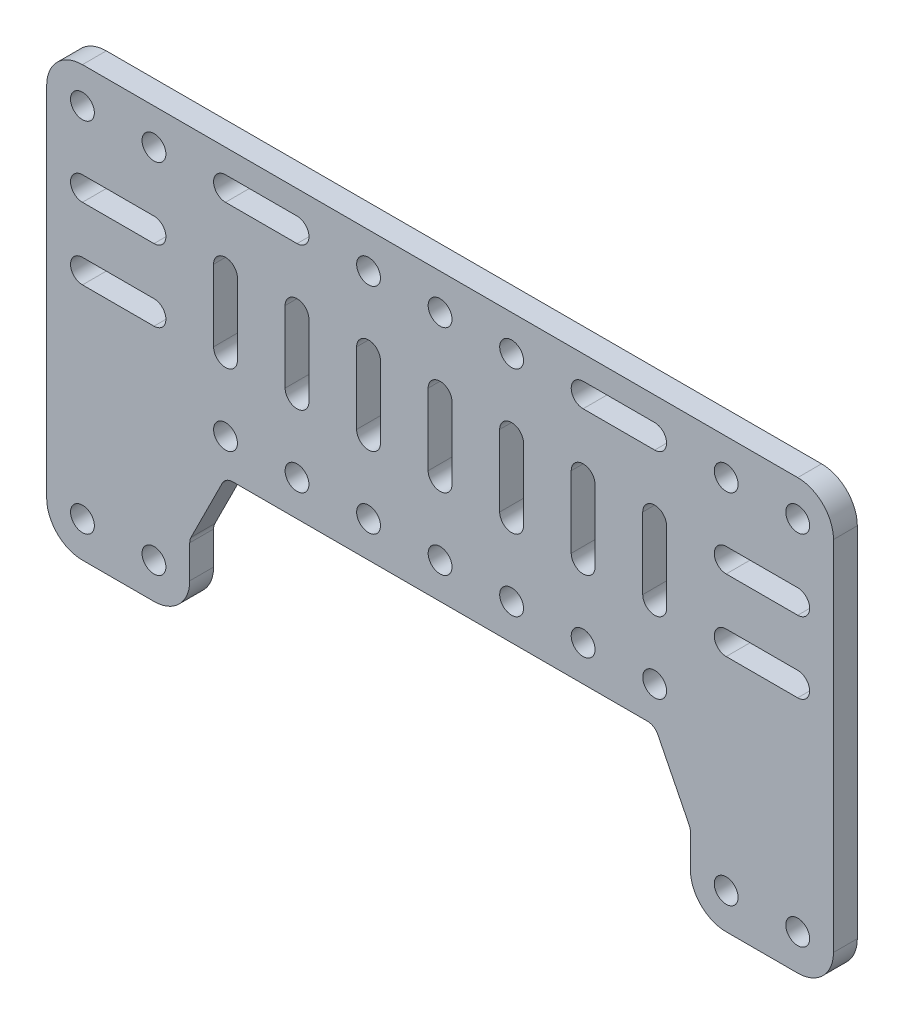
from build123d import *

# Parameters (mm, degrees)
MODEL_R                 = 1.5
SALIENTE_EXTRUIR1_DEPTH = 3


with BuildPart() as part:
    # Model → Saliente-Extruir1 (new body)
    with BuildSketch(Plane.XY):
        with BuildLine():
            ThreePointArc((-1383.726934946, 299.907679238), (-1385.04495443, 303.089659753), (-1388.226934946, 304.407679238))
            Line((-1388.226934946, 304.407679238), (-1478.226934946, 304.407679238))
            ThreePointArc((-1478.226934946, 304.407679238), (-1481.408915461, 303.089659753), (-1482.726934946, 299.907679238))
            Line((-1482.726934946, 299.907679238), (-1482.726934946, 254.907679238))
            ThreePointArc((-1482.726934946, 254.907679238), (-1481.408915461, 251.725698722), (-1478.226934946, 250.407679238))
            Line((-1478.226934946, 250.407679238), (-1469.226934946, 250.407679238))
            ThreePointArc((-1469.226934946, 250.407679238), (-1466.04495443, 251.725698722), (-1464.726934946, 254.907679238))
            Line((-1464.726934946, 254.907679238), (-1464.726934946, 259.053577271))
            ThreePointArc((-1464.726934946, 259.053577271), (-1464.68680843, 259.398206652), (-1464.568575732, 259.724397665))
            Line((-1464.568575732, 259.724397665), (-1460.641524749, 267.578499631))
            ThreePointArc((-1460.641524749, 267.578499631), (-1460.088480631, 268.18365545), (-1459.299883963, 268.407679238))
            Line((-1459.299883963, 268.407679238), (-1407.153985929, 268.407679238))
            ThreePointArc((-1407.153985929, 268.407679238), (-1406.365389261, 268.18365545), (-1405.812345142, 267.578499631))
            Line((-1405.812345142, 267.578499631), (-1401.885294159, 259.724397665))
            ThreePointArc((-1401.885294159, 259.724397665), (-1401.767061462, 259.398206652), (-1401.726934946, 259.053577271))
            Line((-1401.726934946, 259.053577271), (-1401.726934946, 254.907679238))
            ThreePointArc((-1401.726934946, 254.907679238), (-1400.408915461, 251.725698722), (-1397.226934946, 250.407679238))
            Line((-1397.226934946, 250.407679238), (-1388.226934946, 250.407679238))
            ThreePointArc((-1388.226934946, 250.407679238), (-1385.04495443, 251.725698722), (-1383.726934946, 254.907679238))
            Line((-1383.726934946, 254.907679238), (-1383.726934946, 299.907679238))
        make_face()
        with Locations((-1478.226934946, 254.907679238)):
            Circle(MODEL_R, mode=Mode.SUBTRACT)
        with Locations((-1469.226934946, 254.907679238)):
            Circle(MODEL_R, mode=Mode.SUBTRACT)
        with Locations((-1460.226934946, 272.907679238)):
            Circle(MODEL_R, mode=Mode.SUBTRACT)
        with Locations((-1451.226934946, 272.907679238)):
            Circle(MODEL_R, mode=Mode.SUBTRACT)
        with Locations((-1442.226934946, 272.907679238)):
            Circle(MODEL_R, mode=Mode.SUBTRACT)
        with Locations((-1433.226934946, 272.907679238)):
            Circle(MODEL_R, mode=Mode.SUBTRACT)
        with Locations((-1397.226934946, 254.907679238)):
            Circle(MODEL_R, mode=Mode.SUBTRACT)
        with Locations((-1388.226934946, 254.907679238)):
            Circle(MODEL_R, mode=Mode.SUBTRACT)
        with Locations((-1424.226934946, 272.907679238)):
            Circle(MODEL_R, mode=Mode.SUBTRACT)
        with Locations((-1415.226934946, 272.907679238)):
            Circle(MODEL_R, mode=Mode.SUBTRACT)
        with Locations((-1406.226934946, 272.907679238)):
            Circle(MODEL_R, mode=Mode.SUBTRACT)
        with BuildLine():
            Line((-1469.226934946, 280.407679238), (-1478.226934946, 280.407679238))
            ThreePointArc((-1478.226934946, 280.407679238), (-1479.726934946, 281.907679238), (-1478.226934946, 283.407679238))
            Line((-1478.226934946, 283.407679238), (-1469.226934946, 283.407679238))
            ThreePointArc((-1469.226934946, 283.407679238), (-1467.726934946, 281.907679238), (-1469.226934946, 280.407679238))
        make_face(mode=Mode.SUBTRACT)
        with BuildLine():
            ThreePointArc((-1478.226934946, 289.407679238), (-1479.726934946, 290.907679238), (-1478.226934946, 292.407679238))
            Line((-1478.226934946, 292.407679238), (-1469.226934946, 292.407679238))
            ThreePointArc((-1469.226934946, 292.407679238), (-1467.726934946, 290.907679238), (-1469.226934946, 289.407679238))
            Line((-1469.226934946, 289.407679238), (-1478.226934946, 289.407679238))
        make_face(mode=Mode.SUBTRACT)
        with BuildLine():
            Line((-1458.726934946, 290.907679238), (-1458.726934946, 281.907679238))
            ThreePointArc((-1458.726934946, 281.907679238), (-1460.226934946, 280.407679238), (-1461.726934946, 281.907679238))
            Line((-1461.726934946, 281.907679238), (-1461.726934946, 290.907679238))
            ThreePointArc((-1461.726934946, 290.907679238), (-1460.226934946, 292.407679238), (-1458.726934946, 290.907679238))
        make_face(mode=Mode.SUBTRACT)
        with BuildLine():
            Line((-1449.726934946, 290.907679238), (-1449.726934946, 281.907679238))
            ThreePointArc((-1449.726934946, 281.907679238), (-1451.226934946, 280.407679238), (-1452.726934946, 281.907679238))
            Line((-1452.726934946, 281.907679238), (-1452.726934946, 290.907679238))
            ThreePointArc((-1452.726934946, 290.907679238), (-1451.226934946, 292.407679238), (-1449.726934946, 290.907679238))
        make_face(mode=Mode.SUBTRACT)
        with BuildLine():
            Line((-1440.726934946, 290.907679238), (-1440.726934946, 281.907679238))
            ThreePointArc((-1440.726934946, 281.907679238), (-1442.226934946, 280.407679238), (-1443.726934946, 281.907679238))
            Line((-1443.726934946, 281.907679238), (-1443.726934946, 290.907679238))
            ThreePointArc((-1443.726934946, 290.907679238), (-1442.226934946, 292.407679238), (-1440.726934946, 290.907679238))
        make_face(mode=Mode.SUBTRACT)
        with BuildLine():
            Line((-1431.726934946, 290.907679238), (-1431.726934946, 281.907679238))
            ThreePointArc((-1431.726934946, 281.907679238), (-1433.226934946, 280.407679238), (-1434.726934946, 281.907679238))
            Line((-1434.726934946, 281.907679238), (-1434.726934946, 290.907679238))
            ThreePointArc((-1434.726934946, 290.907679238), (-1433.226934946, 292.407679238), (-1431.726934946, 290.907679238))
        make_face(mode=Mode.SUBTRACT)
        with Locations((-1478.226934946, 299.907679238)):
            Circle(MODEL_R, mode=Mode.SUBTRACT)
        with Locations((-1469.226934946, 299.907679238)):
            Circle(MODEL_R, mode=Mode.SUBTRACT)
        with BuildLine():
            Line((-1451.226934946, 298.407679238), (-1460.226934946, 298.407679238))
            ThreePointArc((-1460.226934946, 298.407679238), (-1461.726934946, 299.907679238), (-1460.226934946, 301.407679238))
            Line((-1460.226934946, 301.407679238), (-1451.226934946, 301.407679238))
            ThreePointArc((-1451.226934946, 301.407679238), (-1449.726934946, 299.907679238), (-1451.226934946, 298.407679238))
        make_face(mode=Mode.SUBTRACT)
        with Locations((-1442.226934946, 299.907679238)):
            Circle(MODEL_R, mode=Mode.SUBTRACT)
        with Locations((-1433.226934946, 299.907679238)):
            Circle(MODEL_R, mode=Mode.SUBTRACT)
        with BuildLine():
            Line((-1422.726934946, 290.907679238), (-1422.726934946, 281.907679238))
            ThreePointArc((-1422.726934946, 281.907679238), (-1424.226934946, 280.407679238), (-1425.726934946, 281.907679238))
            Line((-1425.726934946, 281.907679238), (-1425.726934946, 290.907679238))
            ThreePointArc((-1425.726934946, 290.907679238), (-1424.226934946, 292.407679238), (-1422.726934946, 290.907679238))
        make_face(mode=Mode.SUBTRACT)
        with BuildLine():
            Line((-1413.726934946, 290.907679238), (-1413.726934946, 281.907679238))
            ThreePointArc((-1413.726934946, 281.907679238), (-1415.226934946, 280.407679238), (-1416.726934946, 281.907679238))
            Line((-1416.726934946, 281.907679238), (-1416.726934946, 290.907679238))
            ThreePointArc((-1416.726934946, 290.907679238), (-1415.226934946, 292.407679238), (-1413.726934946, 290.907679238))
        make_face(mode=Mode.SUBTRACT)
        with BuildLine():
            Line((-1388.226934946, 280.407679238), (-1397.226934946, 280.407679238))
            ThreePointArc((-1397.226934946, 280.407679238), (-1398.726934946, 281.907679238), (-1397.226934946, 283.407679238))
            Line((-1397.226934946, 283.407679238), (-1388.226934946, 283.407679238))
            ThreePointArc((-1388.226934946, 283.407679238), (-1386.726934946, 281.907679238), (-1388.226934946, 280.407679238))
        make_face(mode=Mode.SUBTRACT)
        with BuildLine():
            Line((-1404.726934946, 290.907679238), (-1404.726934946, 281.907679238))
            ThreePointArc((-1404.726934946, 281.907679238), (-1406.226934946, 280.407679238), (-1407.726934946, 281.907679238))
            Line((-1407.726934946, 281.907679238), (-1407.726934946, 290.907679238))
            ThreePointArc((-1407.726934946, 290.907679238), (-1406.226934946, 292.407679238), (-1404.726934946, 290.907679238))
        make_face(mode=Mode.SUBTRACT)
        with BuildLine():
            ThreePointArc((-1397.226934946, 289.407679238), (-1398.726934946, 290.907679238), (-1397.226934946, 292.407679238))
            Line((-1397.226934946, 292.407679238), (-1388.226934946, 292.407679238))
            ThreePointArc((-1388.226934946, 292.407679238), (-1386.726934946, 290.907679238), (-1388.226934946, 289.407679238))
            Line((-1388.226934946, 289.407679238), (-1397.226934946, 289.407679238))
        make_face(mode=Mode.SUBTRACT)
        with Locations((-1424.226934946, 299.907679238)):
            Circle(MODEL_R, mode=Mode.SUBTRACT)
        with BuildLine():
            ThreePointArc((-1415.226934946, 298.407679238), (-1416.726934946, 299.907679238), (-1415.226934946, 301.407679238))
            Line((-1415.226934946, 301.407679238), (-1406.226934946, 301.407679238))
            ThreePointArc((-1406.226934946, 301.407679238), (-1404.726934946, 299.907679238), (-1406.226934946, 298.407679238))
            Line((-1406.226934946, 298.407679238), (-1415.226934946, 298.407679238))
        make_face(mode=Mode.SUBTRACT)
        with Locations((-1397.226934946, 299.907679238)):
            Circle(MODEL_R, mode=Mode.SUBTRACT)
        with Locations((-1388.226934946, 299.907679238)):
            Circle(MODEL_R, mode=Mode.SUBTRACT)
    extrude(amount=SALIENTE_EXTRUIR1_DEPTH)


solid = part.part
